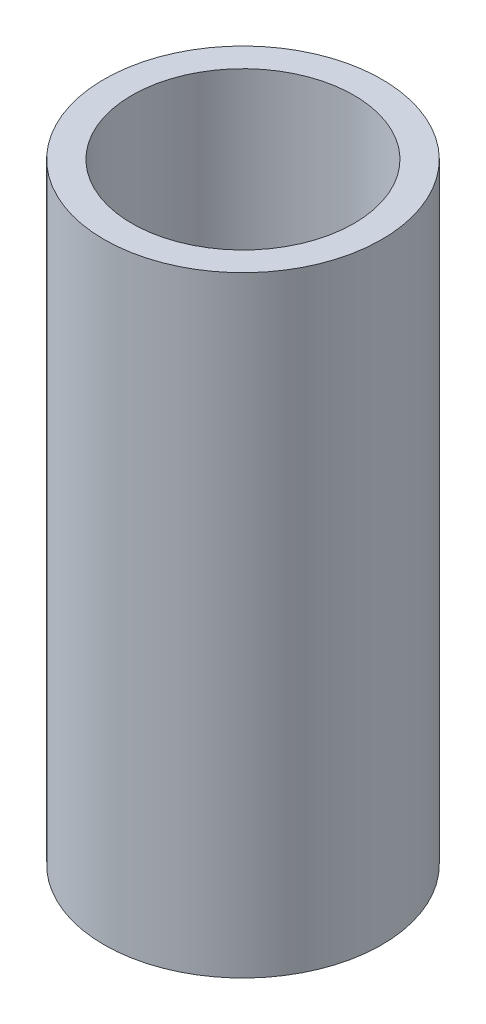
from build123d import *

# Parameters (mm, degrees)
SKETCH_1_R      = 10
SKETCH_1_R_2    = 8
EXTRUDE_1_DEPTH = 44


with BuildPart() as part:
    # 草图1 → 拉伸-薄壁1 (new body)
    with BuildSketch(Plane(origin=(0, 0, 0), x_dir=(1, 0, 0), z_dir=(0, 1, 0))):
        Circle(SKETCH_1_R)
        Circle(SKETCH_1_R_2, mode=Mode.SUBTRACT)
    extrude(amount=EXTRUDE_1_DEPTH)


solid = part.part
